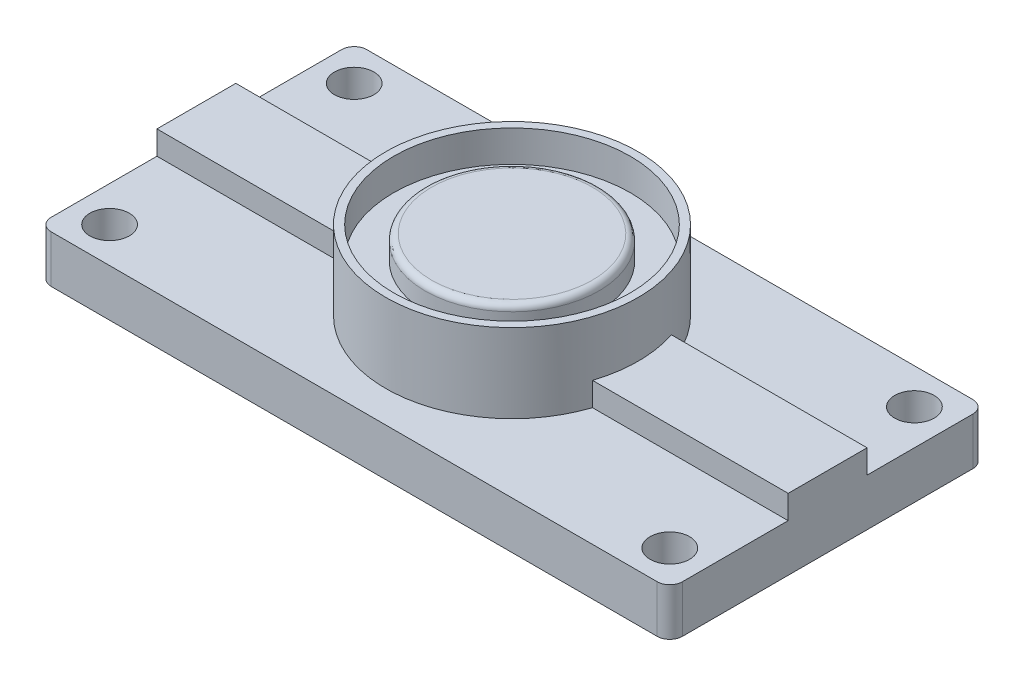
from build123d import *

# Parameters (mm, degrees)
SKETCH1_R           = 8
SKETCH1_R_2         = 1.2500000000000013
BOSS_EXTRUDE1_DEPTH = 3
SKETCH1_5_R         = 8
BOSS_EXTRUDE3_DEPTH = 8
BOSS_EXTRUDE4_DEPTH = 4.5
CUT_EXTRUDE1_DEPTH  = 1
BOSS_EXTRUDE5_DEPTH = 0.5
FILLET1_R           = 0.2
FILLET2_R           = 0.8
SKETCH4_R           = 7.5
SKETCH4_R_2         = 5.5
CUT_EXTRUDE2_DEPTH  = 2
SKETCH4_2_R         = 5.5
CUT_EXTRUDE3_DEPTH  = 0.5
FILLET3_R           = 0.4


with BuildPart() as part:
    # Sketch1 → Boss-Extrude1 (new body)
    with BuildSketch(Plane(origin=(0, 0, 0), x_dir=(1, 0, 0), z_dir=(0, 1, 0))):
        Polygon((-20, 10), (20, 9.999999999999996), (20, -10), (-20, -10), align=None)
        with Locations(Location((0, 0, 0), (0, 0, 270))):
            Circle(SKETCH1_R, mode=Mode.SUBTRACT)
        with Locations(Location((-17.750000000000004, 7.750000000000002, 0), (0, 0, 270))):
            Circle(SKETCH1_R_2, mode=Mode.SUBTRACT)
        with Locations(Location((-17.750000000000004, -7.750000000000002, 0), (0, 0, 90))):
            Circle(SKETCH1_R_2, mode=Mode.SUBTRACT)
        with Locations(Location((17.750000000000004, -7.750000000000002, 0), (0, 0, 270))):
            Circle(SKETCH1_R_2, mode=Mode.SUBTRACT)
        with Locations(Location((17.750000000000004, 7.750000000000002, 0), (0, 0, 90))):
            Circle(SKETCH1_R_2, mode=Mode.SUBTRACT)
    extrude(amount=BOSS_EXTRUDE1_DEPTH)

    # Sketch1<5> → Boss-Extrude3 (add)
    with BuildSketch(Plane(origin=(0, 0, 0), x_dir=(1, 0, 0), z_dir=(0, 1, 0))):
        with Locations(Location((0, 0, 0), (0, 0, 270))):
            Circle(SKETCH1_5_R)
        with BuildLine():
            Line((7.599342076785447, -2.499999999999998), (-7.599342076785446, -2.499999999999998))
            ThreePointArc((-7.599342076785395, -2.499999999999809), (-1.47e-15, -8), (7.599342076785395, -2.4999999999998086))
        make_face()
        with BuildLine():
            ThreePointArc((7.599342076785394, 2.4999999999998113), (4.9e-16, 8), (-7.599342076785393, 2.4999999999998144))
            Line((-7.599342076785444, 2.500000000000002), (7.599342076785447, 2.500000000000002))
        make_face()
    extrude(amount=BOSS_EXTRUDE3_DEPTH)

    # Sketch1<6> → Boss-Extrude4 (add)
    with BuildSketch(Plane(origin=(0, 0, 0), x_dir=(1, 0, 0), z_dir=(0, 1, 0))):
        with BuildLine():
            Line((-7.599342076785444, 2.500000000000002), (-20, 2.500000000000002))
            Line((-20, 2.5000000000000018), (-20, -2.4999999999999982))
            Line((-20, -2.499999999999998), (-7.599342076785446, -2.499999999999998))
            ThreePointArc((-7.599342076785395, -2.499999999999809), (-8, 9.8e-16), (-7.599342076785393, 2.4999999999998144))
        make_face()
        with BuildLine():
            Line((20, -2.4999999999999982), (20, 2.5000000000000018))
            Line((20, 2.500000000000002), (7.599342076785447, 2.500000000000002))
            ThreePointArc((7.599342076785394, 2.4999999999998113), (7.899200485311256, 1.265950904600342), (8, 0))
            ThreePointArc((8, -1.96e-15), (7.899200485311256, -1.2659509046003417), (7.599342076785395, -2.4999999999998086))
            Line((7.599342076785447, -2.499999999999998), (20, -2.499999999999998))
        make_face()
    extrude(amount=BOSS_EXTRUDE4_DEPTH)

    # Sketch2 → Cut-Extrude1 (cut)
    with BuildSketch(Plane.XZ):
        with BuildLine():
            Line((-10, 8), (10, 8))
            ThreePointArc((10, 8), (18, 0), (10, -8))
            Line((10, -8), (-10, -8))
            ThreePointArc((-10, -8), (-18, 9.8e-16), (-10, 8))
        make_face()
    extrude(amount=-CUT_EXTRUDE1_DEPTH, mode=Mode.SUBTRACT)

    # Sketch3 → Boss-Extrude5 (add)
    # profile 1 of 5: a face of its own
    with BuildSketch(Plane.XZ.offset(-1)):
        with BuildLine():
            Line((-10.000000000000002, -7.5), (9.999999999999998, -7.500000000000003))
            ThreePointArc((9.999999999999998, -7.500000000000003), (17.500000000000004, 0), (9.999999999999998, 7.500000000000003))
            Line((9.999999999999998, 7.500000000000003), (-10.000000000000002, 7.5))
            ThreePointArc((-10.000000000000002, 7.5), (-17.5, 9.2e-16), (-10.000000000000002, -7.5))
        make_face()
        with BuildLine():
            ThreePointArc((-10.000000000000002, 6.5), (-16.5, 8e-16), (-10.000000000000002, -6.5))
            Line((-10.000000000000002, -6.5), (9.999999999999998, -6.5))
            ThreePointArc((9.999999999999998, -6.5), (16.5, 0), (9.999999999999998, 6.5))
            Line((9.999999999999998, 6.5), (-10.000000000000002, 6.5))
        make_face(mode=Mode.SUBTRACT)
    # profile 2 of 5: a face of its own
    with BuildSketch(Plane.XZ.offset(-1)):
        with BuildLine():
            ThreePointArc((-4.039971044607726, 4.9e-16), (2.5e-16, 4.039971044607726), (4.039971044607726, 0))
            Line((4.039971044607725, 0), (4.859818377030173, 0))
            ThreePointArc((4.859818377030172, 0), (3e-16, 4.859818377030172), (-4.859818377030172, 6e-16))
            Line((-4.859818377030172, 0), (-4.039971044607726, 0))
        make_face()
    # profile 3 of 5: a face of its own
    with BuildSketch(Plane.XZ.offset(-1)):
        with BuildLine():
            Line((4.859818377030173, 0), (4.039971044607725, 0))
            ThreePointArc((4.039971044607726, -9.9e-16), (-7.4e-16, -4.039971044607726), (-4.039971044607726, 4.9e-16))
            Line((-4.039971044607726, 0), (-4.859818377030172, 0))
            ThreePointArc((-4.859818377030172, 6e-16), (-8.9e-16, -4.859818377030172), (4.859818377030172, -1.19e-15))
        make_face()
    # profile 4 of 5: a face of its own
    with BuildSketch(Plane.XZ.offset(-1)):
        with BuildLine():
            ThreePointArc((-4.039971044607726, 4.9e-16), (2.5e-16, 4.039971044607726), (4.039971044607726, 0))
            Line((4.039971044607725, 0), (4.859818377030173, 0))
            ThreePointArc((4.859818377030172, 0), (3e-16, 4.859818377030172), (-4.859818377030172, 6e-16))
            Line((-4.859818377030172, 0), (-4.039971044607726, 0))
        make_face()
    # profile 5 of 5: a face of its own
    with BuildSketch(Plane.XZ.offset(-1)):
        with BuildLine():
            Line((4.859818377030173, 0), (4.039971044607725, 0))
            ThreePointArc((4.039971044607726, -9.9e-16), (-7.4e-16, -4.039971044607726), (-4.039971044607726, 4.9e-16))
            Line((-4.039971044607726, 0), (-4.859818377030172, 0))
            ThreePointArc((-4.859818377030172, 6e-16), (-8.9e-16, -4.859818377030172), (4.859818377030172, -1.19e-15))
        make_face()
    extrude(amount=BOSS_EXTRUDE5_DEPTH)

    # Fillet1
    fillet1_edges = [part.edges().sort_by_distance(p)[0] for p in [
        (-1.78e-15, 0.5, 7.500000000000002),
        (-16.5, 0.5, 6e-17),
        (-1.78e-15, 1, 6.5),
        (16.5, 0.5, -7.3e-16),
        (-1.78e-15, 0.5, -6.5),
        (-1.78e-15, 0.5, 6.5),
        (-1.78e-15, 0.5, -7.500000000000002),
        (17.500000000000004, 0.5, -5.7e-16),
        (-17.5, 0.5, 7.9e-16),
        (-16.5, 1, 6e-17),
        (-1.78e-15, 1, -6.5),
        (16.5, 1, -7.3e-16),
        (-4.039971044607727, 0.5, 4.9e-16),
        (-4.859818377030172, 1, 6e-16),
        (-4.859818377030172, 0.5, 6e-16),
    ]]
    fillet(fillet1_edges, radius=FILLET1_R)

    # Fillet2
    fillet2_edges = [part.edges().sort_by_distance(p)[0] for p in [
        (-20, 1.5, 10),
        (-20, 1.5, -10),
        (20, 1.5, -9.999999999999996),
        (20, 1.5, 10),
    ]]
    fillet(fillet2_edges, radius=FILLET2_R)

    # Sketch4 → Cut-Extrude2 (cut)
    with BuildSketch(Plane(origin=(0, 8, 0), x_dir=(1, 0, 0), z_dir=(0, 1, 0))):
        with Locations(Location((0, 0, 0), (0, 0, 270))):
            Circle(SKETCH4_R)
        with Locations(Location((0, 0, 0), (0, 0, 270))):
            Circle(SKETCH4_R_2, mode=Mode.SUBTRACT)
    extrude(amount=-CUT_EXTRUDE2_DEPTH, mode=Mode.SUBTRACT)

    # Sketch4<2> → Cut-Extrude3 (cut)
    with BuildSketch(Plane(origin=(0, 8, 0), x_dir=(1, 0, 0), z_dir=(0, 1, 0))):
        with Locations(Location((0, 0, 0), (0, 0, 270))):
            Circle(SKETCH4_2_R)
    extrude(amount=-CUT_EXTRUDE3_DEPTH, mode=Mode.SUBTRACT)

    # Fillet3
    fillet3_edges = [part.edges().sort_by_distance(p)[0] for p in [
        (4.13e-15, 7.5, -5.5),
    ]]
    fillet(fillet3_edges, radius=FILLET3_R)


solid = part.part
